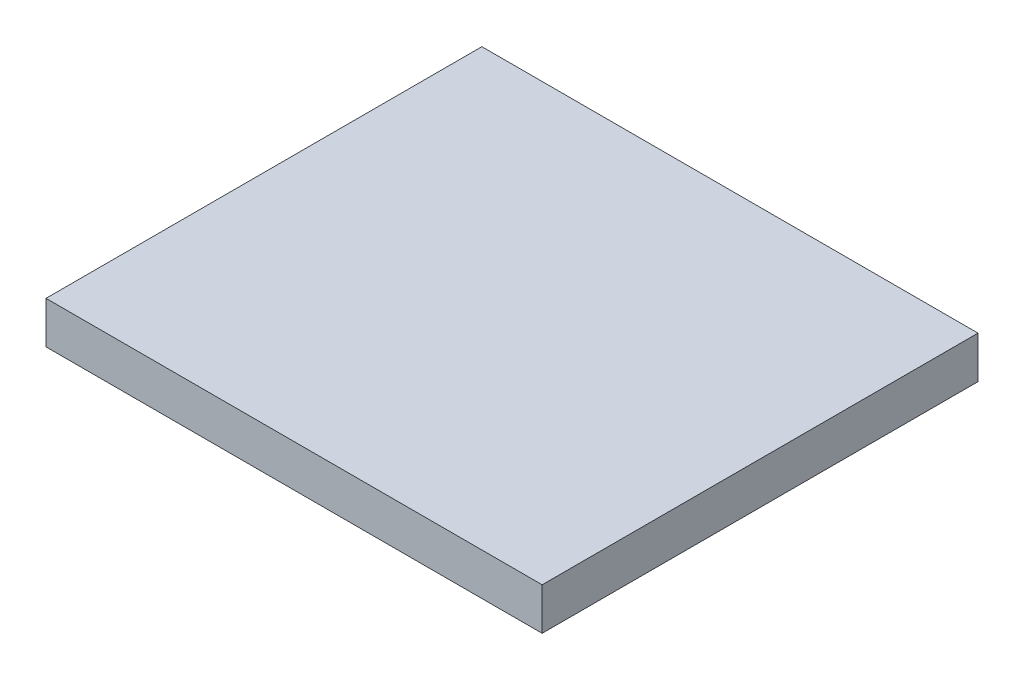
from build123d import *

# Parameters (mm, degrees)
SKETCH1_W           = 35.4
SKETCH1_H           = 31.1
BOSS_EXTRUDE2_DEPTH = 3


with BuildPart() as part:
    # Sketch1 → Boss-Extrude2 (new body)
    with BuildSketch(Plane(origin=(0, 0, 0), x_dir=(1, 0, 0), z_dir=(0, 1, 0))):
        Rectangle(SKETCH1_W, SKETCH1_H)
    extrude(amount=BOSS_EXTRUDE2_DEPTH)


solid = part.part
